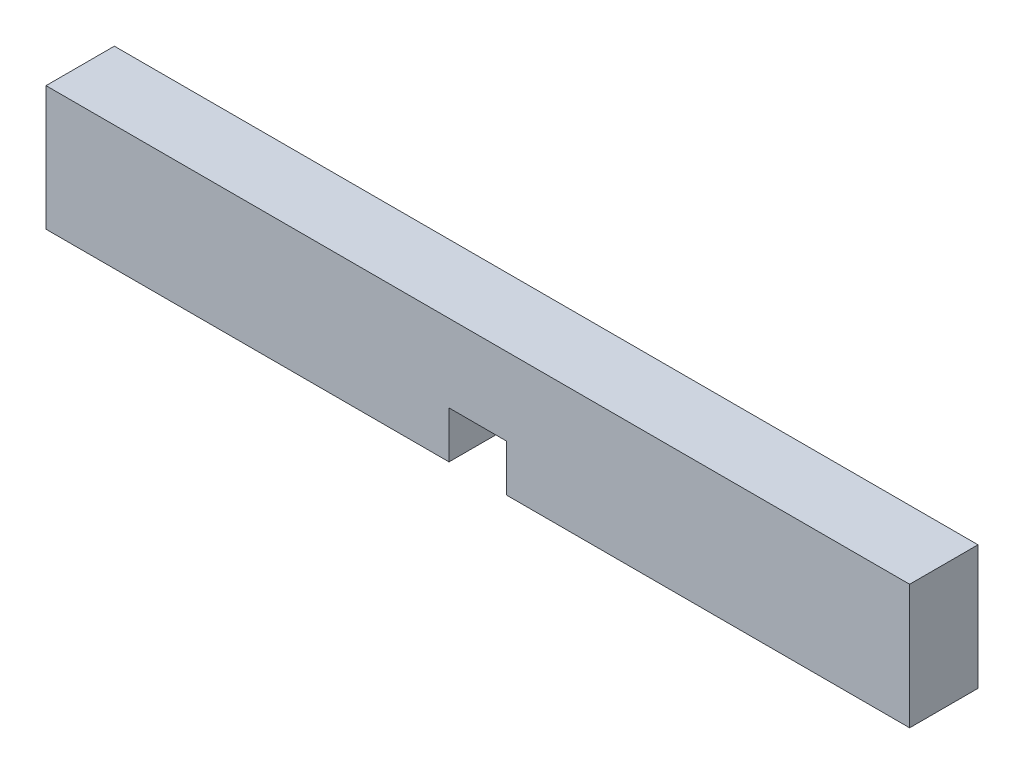
from build123d import *

# Parameters (mm, degrees)
SALIENTE_EXTRUIR1_DEPTH = 2.375


with BuildPart() as part:
    # Croquis1 → Saliente-Extruir1 (new, symmetric)
    with BuildSketch(Plane.XY):
        Polygon((-30, 4.32), (-30, -4.32), (-2, -4.32), (-2, -1.07), (2, -1.07), (2, -4.32), (30, -4.32), (30, 4.32), align=None)
    extrude(amount=SALIENTE_EXTRUIR1_DEPTH, both=True)


solid = part.part
